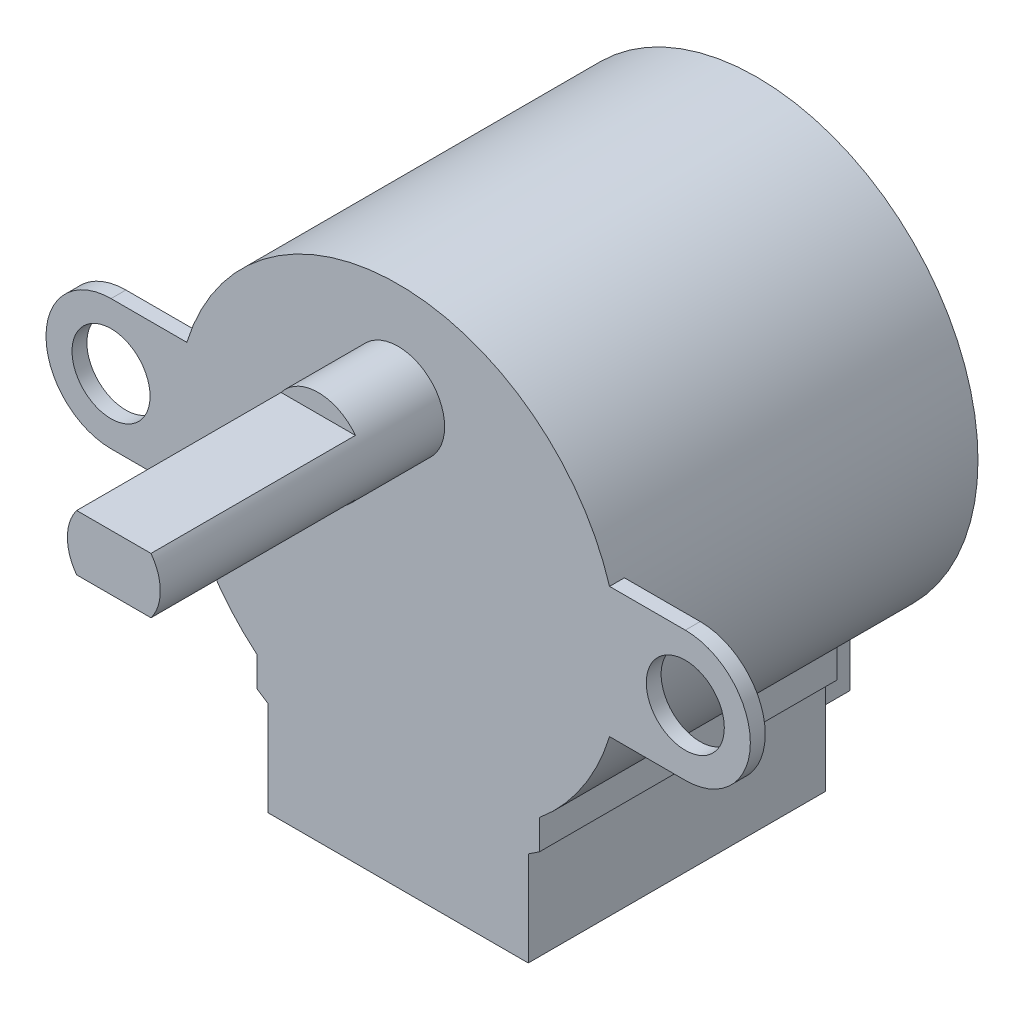
from build123d import *

# Parameters (mm, degrees)
HOUSING_BOSS_EXTRUDE1_DEPTH           = 19.3
PLASTIC_SHEILDING_BOSS_EXTRUDE2_DEPTH = 16
SKETCH5_R                             = 2.1
MOUNTING_BRACKETS_BOSS_EXTRUDE3_DEPTH = 0.8
SKETCH6_R                             = 2.5
SHAFT_BOSS_EXTRUDE4_DEPTH             = 15.3
SHAFT_START                           = -11
SHAFT_EDGECUT_EXTRUDE1_DEPTH          = 11
CABLE_HOLE_CUT_EXTRUDE2_DEPTH         = 5


with BuildPart() as part:
    # Sketch2 → Housing Boss-Extrude1 (new body)
    with BuildSketch(Plane.XY):
        with BuildLine():
            Line((-5, -14.198611022), (0, -14.198611022))
            Line((0, -14.198611022), (5, -14.198611022))
            Line((5, -14.198611022), (5, -10.798611022))
            ThreePointArc((5, -10.798611022), (0, 11.9), (-5, -10.798611022))
            Line((-5, -10.798611022), (-5, -14.198611022))
        make_face()
    extrude(amount=-HOUSING_BOSS_EXTRUDE1_DEPTH)

    # Sketch4 → Plastic Sheilding Boss-Extrude2 (add)
    with BuildSketch(Plane.XY):
        with BuildLine():
            Line((0, -16.237711219), (-7, -16.237711219))
            Line((-7, -16.237711219), (-7, -11.151536254))
            Line((-7, -11.151536254), (-7.6, -10.756964563))
            Line((-7.6, -10.756964563), (-7.6, -9.156964563))
            ThreePointArc((-7.6, -9.156964563), (-6.353247262, -10.06211952), (-5, -10.798611022))
            Line((-5, -10.798611022), (-5, -14.198611022))
            Line((-5, -14.198611022), (5, -14.198611022))
            Line((5, -14.198611022), (5, -10.798611022))
            ThreePointArc((5, -10.798611022), (6.353247262, -10.06211952), (7.6, -9.156964563))
            Line((7.6, -9.156964563), (7.6, -10.756964563))
            Line((7.6, -10.756964563), (7, -11.151536254))
            Line((7, -11.151536254), (7, -16.237711219))
            Line((7, -16.237711219), (0, -16.237711219))
        make_face()
    extrude(amount=-PLASTIC_SHEILDING_BOSS_EXTRUDE2_DEPTH)

    # Sketch5 → Mounting Brackets Boss-Extrude3 (add)
    # profile 1 of 2: a face of its own
    with BuildSketch(Plane.XY):
        with BuildLine():
            Line((-15.45, 3.5), (-11.373653766, 3.5))
            ThreePointArc((-11.373653766, 3.5), (-11.9, 0), (-11.373653766, -3.5))
            Line((-11.373653766, -3.5), (-15.45, -3.5))
            ThreePointArc((-15.45, -3.5), (-18.95, 0), (-15.45, 3.5))
        make_face()
        with Locations((-15.45, 0)):
            Circle(SKETCH5_R, mode=Mode.SUBTRACT)
    # profile 2 of 2: a face of its own
    with BuildSketch(Plane.XY):
        with BuildLine():
            Line((15.45, 3.5), (11.373653766, 3.5))
            ThreePointArc((11.373653766, 3.5), (11.9, 0), (11.373653766, -3.5))
            Line((11.373653766, -3.5), (15.45, -3.5))
            ThreePointArc((15.45, -3.5), (18.95, 0), (15.45, 3.5))
        make_face()
        with Locations((15.45, 0)):
            Circle(SKETCH5_R, mode=Mode.SUBTRACT)
    extrude(amount=-MOUNTING_BRACKETS_BOSS_EXTRUDE3_DEPTH)

    # Sketch6 → Shaft Boss-Extrude4 (add)
    with BuildSketch(Plane.XY):
        with Locations((0, 6.5)):
            Circle(SKETCH6_R)
    extrude(amount=SHAFT_BOSS_EXTRUDE4_DEPTH)

    # Sketch7 → Shaft EdgeCut-Extrude1 (cut)
    with BuildSketch(Plane.XY.offset(15.3).offset(SHAFT_START)):
        with BuildLine():
            Line((-2, 8), (2, 8))
            ThreePointArc((2, 8), (0, 9), (-2, 8))
        make_face()
        with BuildLine():
            Line((-2, 5), (2, 5))
            ThreePointArc((2, 5), (0, 4), (-2, 5))
        make_face()
    extrude(amount=SHAFT_EDGECUT_EXTRUDE1_DEPTH, mode=Mode.SUBTRACT)

    # Sketch8 → Cable Hole Cut-Extrude2 (cut)
    with BuildSketch(Plane.XZ.offset(16.237711219)):
        Polygon((0, -2), (3.25, -2), (3.25, -3.2), (0, -3.2), (-3.25, -3.2), (-3.25, -2), align=None)
    extrude(amount=-CABLE_HOLE_CUT_EXTRUDE2_DEPTH, mode=Mode.SUBTRACT)


solid = part.part
